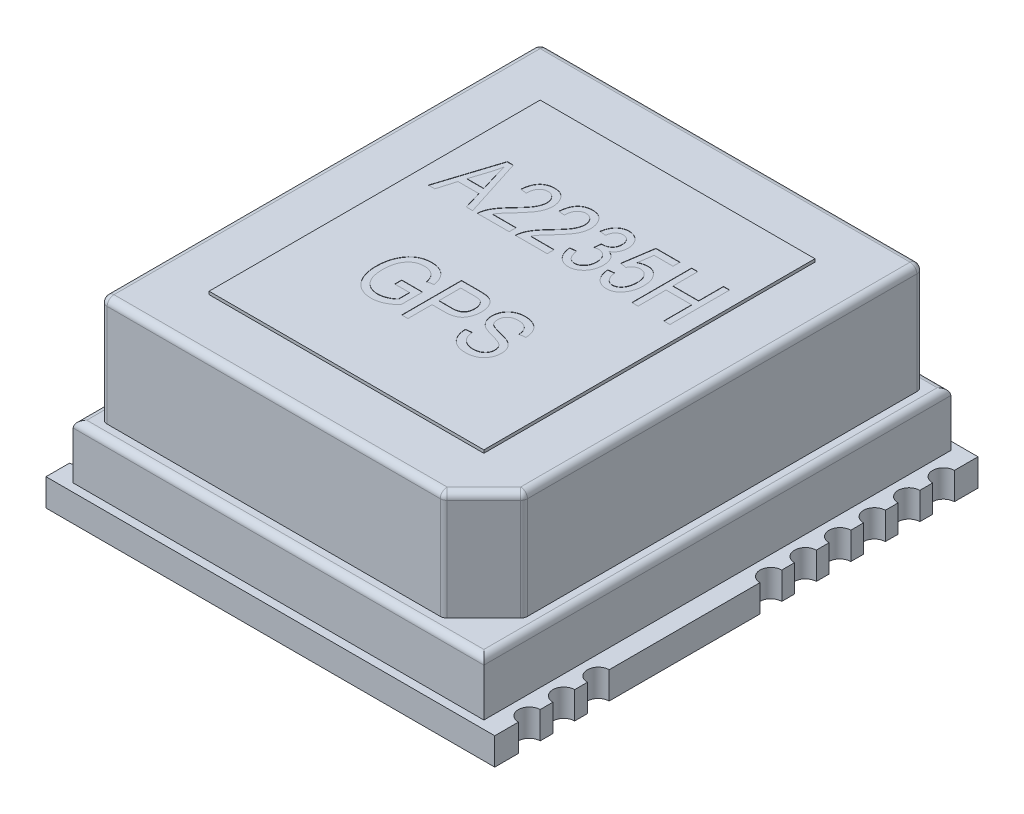
from build123d import *

# Parameters (mm, degrees)
SKETCH1_W           = 16.51
SKETCH1_H           = 17.78
BOSS_EXTRUDE1_DEPTH = 1
CUT_EXTRUDE1_DEPTH  = 1
SKETCH3_W           = 15.11
SKETCH3_H           = 17.18
BOSS_EXTRUDE2_DEPTH = 2
BOSS_EXTRUDE3_DEPTH = 4
SKETCH6_W           = 10.11
SKETCH6_H           = 12.18
BOSS_EXTRUDE4_DEPTH = 0.11
CUT_EXTRUDE2_DEPTH  = 0.01
FILLET1_R           = 0.25
FILLET2_R           = 0.25


with BuildPart() as part:
    # Sketch1 → Boss-Extrude1 (new body)
    with BuildSketch(Plane(origin=(0, 0, 0), x_dir=(1, 0, 0), z_dir=(0, 1, 0))):
        Rectangle(SKETCH1_W, SKETCH1_H)
    extrude(amount=BOSS_EXTRUDE1_DEPTH)

    # Sketch2 → Cut-Extrude1 (cut)
    with BuildSketch(Plane(origin=(0, 1, 0), x_dir=(1, 0, 0), z_dir=(0, 1, 0))):
        with BuildLine():
            ThreePointArc((-7.855, 7.62), (-7.972157288, 7.902842712), (-8.255, 8.02))
            Line((-8.255, 8.02), (-8.255, 7.22))
            ThreePointArc((-8.255, 7.22), (-7.972157288, 7.337157288), (-7.855, 7.62))
        make_face()
        with BuildLine():
            Line((-8.255, 7.22), (-8.255, 8.02))
            ThreePointArc((-8.255, 8.02), (-8.655, 7.62), (-8.255, 7.22))
        make_face()
        with BuildLine():
            ThreePointArc((-7.855, 7.62), (-7.972157288, 7.902842712), (-8.255, 8.02))
            Line((-8.255, 8.02), (-8.255, 7.22))
            ThreePointArc((-8.255, 7.22), (-7.972157288, 7.337157288), (-7.855, 7.62))
        make_face()
        with BuildLine():
            Line((-8.255, 7.22), (-8.255, 8.02))
            ThreePointArc((-8.255, 8.02), (-8.655, 7.62), (-8.255, 7.22))
        make_face()
        with BuildLine():
            ThreePointArc((-7.855, 6.35), (-7.972157288, 6.632842712), (-8.255, 6.75))
            Line((-8.255, 6.75), (-8.255, 5.95))
            ThreePointArc((-8.255, 5.95), (-7.972157288, 6.067157288), (-7.855, 6.35))
        make_face()
        with BuildLine():
            Line((-8.255, 5.95), (-8.255, 6.75))
            ThreePointArc((-8.255, 6.75), (-8.655, 6.35), (-8.255, 5.95))
        make_face()
        with BuildLine():
            ThreePointArc((-7.855, 6.35), (-7.972157288, 6.632842712), (-8.255, 6.75))
            Line((-8.255, 6.75), (-8.255, 5.95))
            ThreePointArc((-8.255, 5.95), (-7.972157288, 6.067157288), (-7.855, 6.35))
        make_face()
        with BuildLine():
            Line((-8.255, 5.95), (-8.255, 6.75))
            ThreePointArc((-8.255, 6.75), (-8.655, 6.35), (-8.255, 5.95))
        make_face()
        with BuildLine():
            ThreePointArc((-7.855, 5.08), (-7.972157288, 5.362842712), (-8.255, 5.48))
            Line((-8.255, 5.48), (-8.255, 4.68))
            ThreePointArc((-8.255, 4.68), (-7.972157288, 4.797157288), (-7.855, 5.08))
        make_face()
        with BuildLine():
            Line((-8.255, 4.68), (-8.255, 5.48))
            ThreePointArc((-8.255, 5.48), (-8.655, 5.08), (-8.255, 4.68))
        make_face()
        with BuildLine():
            ThreePointArc((-7.855, 5.08), (-7.972157288, 5.362842712), (-8.255, 5.48))
            Line((-8.255, 5.48), (-8.255, 4.68))
            ThreePointArc((-8.255, 4.68), (-7.972157288, 4.797157288), (-7.855, 5.08))
        make_face()
        with BuildLine():
            Line((-8.255, 4.68), (-8.255, 5.48))
            ThreePointArc((-8.255, 5.48), (-8.655, 5.08), (-8.255, 4.68))
        make_face()
        with BuildLine():
            ThreePointArc((-7.855, 3.81), (-7.972157288, 4.092842712), (-8.255, 4.21))
            Line((-8.255, 4.21), (-8.255, 3.41))
            ThreePointArc((-8.255, 3.41), (-7.972157288, 3.527157288), (-7.855, 3.81))
        make_face()
        with BuildLine():
            Line((-8.255, 3.41), (-8.255, 4.21))
            ThreePointArc((-8.255, 4.21), (-8.655, 3.81), (-8.255, 3.41))
        make_face()
        with BuildLine():
            ThreePointArc((-7.855, 3.81), (-7.972157288, 4.092842712), (-8.255, 4.21))
            Line((-8.255, 4.21), (-8.255, 3.41))
            ThreePointArc((-8.255, 3.41), (-7.972157288, 3.527157288), (-7.855, 3.81))
        make_face()
        with BuildLine():
            Line((-8.255, 3.41), (-8.255, 4.21))
            ThreePointArc((-8.255, 4.21), (-8.655, 3.81), (-8.255, 3.41))
        make_face()
        with BuildLine():
            ThreePointArc((-7.855, 2.54), (-7.972157288, 2.822842712), (-8.255, 2.94))
            Line((-8.255, 2.94), (-8.255, 2.14))
            ThreePointArc((-8.255, 2.14), (-7.972157288, 2.257157288), (-7.855, 2.54))
        make_face()
        with BuildLine():
            Line((-8.255, 2.14), (-8.255, 2.94))
            ThreePointArc((-8.255, 2.94), (-8.655, 2.54), (-8.255, 2.14))
        make_face()
        with BuildLine():
            ThreePointArc((-7.855, 2.54), (-7.972157288, 2.822842712), (-8.255, 2.94))
            Line((-8.255, 2.94), (-8.255, 2.14))
            ThreePointArc((-8.255, 2.14), (-7.972157288, 2.257157288), (-7.855, 2.54))
        make_face()
        with BuildLine():
            Line((-8.255, 2.14), (-8.255, 2.94))
            ThreePointArc((-8.255, 2.94), (-8.655, 2.54), (-8.255, 2.14))
        make_face()
        with BuildLine():
            ThreePointArc((-7.855, 1.27), (-7.972157288, 1.552842712), (-8.255, 1.67))
            Line((-8.255, 1.67), (-8.255, 0.87))
            ThreePointArc((-8.255, 0.87), (-7.972157288, 0.987157288), (-7.855, 1.27))
        make_face()
        with BuildLine():
            Line((-8.255, 0.87), (-8.255, 1.67))
            ThreePointArc((-8.255, 1.67), (-8.655, 1.27), (-8.255, 0.87))
        make_face()
        with BuildLine():
            ThreePointArc((-7.855, 1.27), (-7.972157288, 1.552842712), (-8.255, 1.67))
            Line((-8.255, 1.67), (-8.255, 0.87))
            ThreePointArc((-8.255, 0.87), (-7.972157288, 0.987157288), (-7.855, 1.27))
        make_face()
        with BuildLine():
            Line((-8.255, 0.87), (-8.255, 1.67))
            ThreePointArc((-8.255, 1.67), (-8.655, 1.27), (-8.255, 0.87))
        make_face()
        with BuildLine():
            ThreePointArc((-7.855, 0), (-7.972157288, 0.282842712), (-8.255, 0.4))
            Line((-8.255, 0.4), (-8.255, -0.4))
            ThreePointArc((-8.255, -0.4), (-7.972157288, -0.282842712), (-7.855, 0))
        make_face()
        with BuildLine():
            Line((-8.255, -0.4), (-8.255, 0.4))
            ThreePointArc((-8.255, 0.4), (-8.655, 0), (-8.255, -0.4))
        make_face()
        with BuildLine():
            ThreePointArc((-7.855, 0), (-7.972157288, 0.282842712), (-8.255, 0.4))
            Line((-8.255, 0.4), (-8.255, -0.4))
            ThreePointArc((-8.255, -0.4), (-7.972157288, -0.282842712), (-7.855, 0))
        make_face()
        with BuildLine():
            Line((-8.255, -0.4), (-8.255, 0.4))
            ThreePointArc((-8.255, 0.4), (-8.655, 0), (-8.255, -0.4))
        make_face()
        with BuildLine():
            ThreePointArc((-7.855, -1.27), (-7.972157288, -0.987157288), (-8.255, -0.87))
            Line((-8.255, -0.87), (-8.255, -1.67))
            ThreePointArc((-8.255, -1.67), (-7.972157288, -1.552842712), (-7.855, -1.27))
        make_face()
        with BuildLine():
            Line((-8.255, -1.67), (-8.255, -0.87))
            ThreePointArc((-8.255, -0.87), (-8.655, -1.27), (-8.255, -1.67))
        make_face()
        with BuildLine():
            ThreePointArc((-7.855, -1.27), (-7.972157288, -0.987157288), (-8.255, -0.87))
            Line((-8.255, -0.87), (-8.255, -1.67))
            ThreePointArc((-8.255, -1.67), (-7.972157288, -1.552842712), (-7.855, -1.27))
        make_face()
        with BuildLine():
            Line((-8.255, -1.67), (-8.255, -0.87))
            ThreePointArc((-8.255, -0.87), (-8.655, -1.27), (-8.255, -1.67))
        make_face()
        with BuildLine():
            ThreePointArc((-7.855, -2.54), (-7.972157288, -2.257157288), (-8.255, -2.14))
            Line((-8.255, -2.14), (-8.255, -2.94))
            ThreePointArc((-8.255, -2.94), (-7.972157288, -2.822842712), (-7.855, -2.54))
        make_face()
        with BuildLine():
            Line((-8.255, -2.94), (-8.255, -2.14))
            ThreePointArc((-8.255, -2.14), (-8.655, -2.54), (-8.255, -2.94))
        make_face()
        with BuildLine():
            ThreePointArc((-7.855, -2.54), (-7.972157288, -2.257157288), (-8.255, -2.14))
            Line((-8.255, -2.14), (-8.255, -2.94))
            ThreePointArc((-8.255, -2.94), (-7.972157288, -2.822842712), (-7.855, -2.54))
        make_face()
        with BuildLine():
            Line((-8.255, -2.94), (-8.255, -2.14))
            ThreePointArc((-8.255, -2.14), (-8.655, -2.54), (-8.255, -2.94))
        make_face()
        with BuildLine():
            ThreePointArc((-7.855, -3.81), (-7.972157288, -3.527157288), (-8.255, -3.41))
            Line((-8.255, -3.41), (-8.255, -4.21))
            ThreePointArc((-8.255, -4.21), (-7.972157288, -4.092842712), (-7.855, -3.81))
        make_face()
        with BuildLine():
            Line((-8.255, -4.21), (-8.255, -3.41))
            ThreePointArc((-8.255, -3.41), (-8.655, -3.81), (-8.255, -4.21))
        make_face()
        with BuildLine():
            ThreePointArc((-7.855, -3.81), (-7.972157288, -3.527157288), (-8.255, -3.41))
            Line((-8.255, -3.41), (-8.255, -4.21))
            ThreePointArc((-8.255, -4.21), (-7.972157288, -4.092842712), (-7.855, -3.81))
        make_face()
        with BuildLine():
            Line((-8.255, -4.21), (-8.255, -3.41))
            ThreePointArc((-8.255, -3.41), (-8.655, -3.81), (-8.255, -4.21))
        make_face()
        with BuildLine():
            ThreePointArc((-7.855, -5.08), (-7.972157288, -4.797157288), (-8.255, -4.68))
            Line((-8.255, -4.68), (-8.255, -5.48))
            ThreePointArc((-8.255, -5.48), (-7.972157288, -5.362842712), (-7.855, -5.08))
        make_face()
        with BuildLine():
            Line((-8.255, -5.48), (-8.255, -4.68))
            ThreePointArc((-8.255, -4.68), (-8.655, -5.08), (-8.255, -5.48))
        make_face()
        with BuildLine():
            ThreePointArc((-7.855, -5.08), (-7.972157288, -4.797157288), (-8.255, -4.68))
            Line((-8.255, -4.68), (-8.255, -5.48))
            ThreePointArc((-8.255, -5.48), (-7.972157288, -5.362842712), (-7.855, -5.08))
        make_face()
        with BuildLine():
            Line((-8.255, -5.48), (-8.255, -4.68))
            ThreePointArc((-8.255, -4.68), (-8.655, -5.08), (-8.255, -5.48))
        make_face()
        with BuildLine():
            ThreePointArc((-7.855, -6.35), (-7.972157288, -6.067157288), (-8.255, -5.95))
            Line((-8.255, -5.95), (-8.255, -6.75))
            ThreePointArc((-8.255, -6.75), (-7.972157288, -6.632842712), (-7.855, -6.35))
        make_face()
        with BuildLine():
            Line((-8.255, -6.75), (-8.255, -5.95))
            ThreePointArc((-8.255, -5.95), (-8.655, -6.35), (-8.255, -6.75))
        make_face()
        with BuildLine():
            ThreePointArc((-7.855, -6.35), (-7.972157288, -6.067157288), (-8.255, -5.95))
            Line((-8.255, -5.95), (-8.255, -6.75))
            ThreePointArc((-8.255, -6.75), (-7.972157288, -6.632842712), (-7.855, -6.35))
        make_face()
        with BuildLine():
            Line((-8.255, -6.75), (-8.255, -5.95))
            ThreePointArc((-8.255, -5.95), (-8.655, -6.35), (-8.255, -6.75))
        make_face()
        with BuildLine():
            ThreePointArc((-7.855, -7.62), (-7.972157288, -7.337157288), (-8.255, -7.22))
            Line((-8.255, -7.22), (-8.255, -8.02))
            ThreePointArc((-8.255, -8.02), (-7.972157288, -7.902842712), (-7.855, -7.62))
        make_face()
        with BuildLine():
            Line((-8.255, -8.02), (-8.255, -7.22))
            ThreePointArc((-8.255, -7.22), (-8.655, -7.62), (-8.255, -8.02))
        make_face()
        with BuildLine():
            ThreePointArc((-7.855, -7.62), (-7.972157288, -7.337157288), (-8.255, -7.22))
            Line((-8.255, -7.22), (-8.255, -8.02))
            ThreePointArc((-8.255, -8.02), (-7.972157288, -7.902842712), (-7.855, -7.62))
        make_face()
        with BuildLine():
            Line((-8.255, -8.02), (-8.255, -7.22))
            ThreePointArc((-8.255, -7.22), (-8.655, -7.62), (-8.255, -8.02))
        make_face()
        with BuildLine():
            ThreePointArc((8.655, 7.62), (8.537842712, 7.902842712), (8.255, 8.02))
            Line((8.255, 8.02), (8.255, 7.22))
            ThreePointArc((8.255, 7.22), (8.537842712, 7.337157288), (8.655, 7.62))
        make_face()
        with BuildLine():
            Line((8.255, 7.22), (8.255, 8.02))
            ThreePointArc((8.255, 8.02), (7.855, 7.62), (8.255, 7.22))
        make_face()
        with BuildLine():
            ThreePointArc((8.655, 7.62), (8.537842712, 7.902842712), (8.255, 8.02))
            Line((8.255, 8.02), (8.255, 7.22))
            ThreePointArc((8.255, 7.22), (8.537842712, 7.337157288), (8.655, 7.62))
        make_face()
        with BuildLine():
            Line((8.255, 7.22), (8.255, 8.02))
            ThreePointArc((8.255, 8.02), (7.855, 7.62), (8.255, 7.22))
        make_face()
        with BuildLine():
            ThreePointArc((8.655, 6.35), (8.537842712, 6.632842712), (8.255, 6.75))
            Line((8.255, 6.75), (8.255, 5.95))
            ThreePointArc((8.255, 5.95), (8.537842712, 6.067157288), (8.655, 6.35))
        make_face()
        with BuildLine():
            Line((8.255, 5.95), (8.255, 6.75))
            ThreePointArc((8.255, 6.75), (7.855, 6.35), (8.255, 5.95))
        make_face()
        with BuildLine():
            ThreePointArc((8.655, 6.35), (8.537842712, 6.632842712), (8.255, 6.75))
            Line((8.255, 6.75), (8.255, 5.95))
            ThreePointArc((8.255, 5.95), (8.537842712, 6.067157288), (8.655, 6.35))
        make_face()
        with BuildLine():
            Line((8.255, 5.95), (8.255, 6.75))
            ThreePointArc((8.255, 6.75), (7.855, 6.35), (8.255, 5.95))
        make_face()
        with BuildLine():
            ThreePointArc((8.655, 5.08), (8.537842712, 5.362842712), (8.255, 5.48))
            Line((8.255, 5.48), (8.255, 4.68))
            ThreePointArc((8.255, 4.68), (8.537842712, 4.797157288), (8.655, 5.08))
        make_face()
        with BuildLine():
            Line((8.255, 4.68), (8.255, 5.48))
            ThreePointArc((8.255, 5.48), (7.855, 5.08), (8.255, 4.68))
        make_face()
        with BuildLine():
            ThreePointArc((8.655, 5.08), (8.537842712, 5.362842712), (8.255, 5.48))
            Line((8.255, 5.48), (8.255, 4.68))
            ThreePointArc((8.255, 4.68), (8.537842712, 4.797157288), (8.655, 5.08))
        make_face()
        with BuildLine():
            Line((8.255, 4.68), (8.255, 5.48))
            ThreePointArc((8.255, 5.48), (7.855, 5.08), (8.255, 4.68))
        make_face()
        with BuildLine():
            ThreePointArc((8.655, 3.81), (8.537842712, 4.092842712), (8.255, 4.21))
            Line((8.255, 4.21), (8.255, 3.41))
            ThreePointArc((8.255, 3.41), (8.537842712, 3.527157288), (8.655, 3.81))
        make_face()
        with BuildLine():
            Line((8.255, 3.41), (8.255, 4.21))
            ThreePointArc((8.255, 4.21), (7.855, 3.81), (8.255, 3.41))
        make_face()
        with BuildLine():
            ThreePointArc((8.655, 3.81), (8.537842712, 4.092842712), (8.255, 4.21))
            Line((8.255, 4.21), (8.255, 3.41))
            ThreePointArc((8.255, 3.41), (8.537842712, 3.527157288), (8.655, 3.81))
        make_face()
        with BuildLine():
            Line((8.255, 3.41), (8.255, 4.21))
            ThreePointArc((8.255, 4.21), (7.855, 3.81), (8.255, 3.41))
        make_face()
        with BuildLine():
            ThreePointArc((8.655, 2.54), (8.537842712, 2.822842712), (8.255, 2.94))
            Line((8.255, 2.94), (8.255, 2.14))
            ThreePointArc((8.255, 2.14), (8.537842712, 2.257157288), (8.655, 2.54))
        make_face()
        with BuildLine():
            Line((8.255, 2.14), (8.255, 2.94))
            ThreePointArc((8.255, 2.94), (7.855, 2.54), (8.255, 2.14))
        make_face()
        with BuildLine():
            ThreePointArc((8.655, 2.54), (8.537842712, 2.822842712), (8.255, 2.94))
            Line((8.255, 2.94), (8.255, 2.14))
            ThreePointArc((8.255, 2.14), (8.537842712, 2.257157288), (8.655, 2.54))
        make_face()
        with BuildLine():
            Line((8.255, 2.14), (8.255, 2.94))
            ThreePointArc((8.255, 2.94), (7.855, 2.54), (8.255, 2.14))
        make_face()
        with BuildLine():
            ThreePointArc((8.655, 1.27), (8.537842712, 1.552842712), (8.255, 1.67))
            Line((8.255, 1.67), (8.255, 0.87))
            ThreePointArc((8.255, 0.87), (8.537842712, 0.987157288), (8.655, 1.27))
        make_face()
        with BuildLine():
            Line((8.255, 0.87), (8.255, 1.67))
            ThreePointArc((8.255, 1.67), (7.855, 1.27), (8.255, 0.87))
        make_face()
        with BuildLine():
            ThreePointArc((8.655, 1.27), (8.537842712, 1.552842712), (8.255, 1.67))
            Line((8.255, 1.67), (8.255, 0.87))
            ThreePointArc((8.255, 0.87), (8.537842712, 0.987157288), (8.655, 1.27))
        make_face()
        with BuildLine():
            Line((8.255, 0.87), (8.255, 1.67))
            ThreePointArc((8.255, 1.67), (7.855, 1.27), (8.255, 0.87))
        make_face()
        with BuildLine():
            ThreePointArc((8.655, -5.08), (8.537842712, -4.797157288), (8.255, -4.68))
            Line((8.255, -4.68), (8.255, -5.48))
            ThreePointArc((8.255, -5.48), (8.537842712, -5.362842712), (8.655, -5.08))
        make_face()
        with BuildLine():
            Line((8.255, -5.48), (8.255, -4.68))
            ThreePointArc((8.255, -4.68), (7.855, -5.08), (8.255, -5.48))
        make_face()
        with BuildLine():
            ThreePointArc((8.655, -5.08), (8.537842712, -4.797157288), (8.255, -4.68))
            Line((8.255, -4.68), (8.255, -5.48))
            ThreePointArc((8.255, -5.48), (8.537842712, -5.362842712), (8.655, -5.08))
        make_face()
        with BuildLine():
            Line((8.255, -5.48), (8.255, -4.68))
            ThreePointArc((8.255, -4.68), (7.855, -5.08), (8.255, -5.48))
        make_face()
        with BuildLine():
            ThreePointArc((8.655, -6.35), (8.537842712, -6.067157288), (8.255, -5.95))
            Line((8.255, -5.95), (8.255, -6.75))
            ThreePointArc((8.255, -6.75), (8.537842712, -6.632842712), (8.655, -6.35))
        make_face()
        with BuildLine():
            Line((8.255, -6.75), (8.255, -5.95))
            ThreePointArc((8.255, -5.95), (7.855, -6.35), (8.255, -6.75))
        make_face()
        with BuildLine():
            ThreePointArc((8.655, -6.35), (8.537842712, -6.067157288), (8.255, -5.95))
            Line((8.255, -5.95), (8.255, -6.75))
            ThreePointArc((8.255, -6.75), (8.537842712, -6.632842712), (8.655, -6.35))
        make_face()
        with BuildLine():
            Line((8.255, -6.75), (8.255, -5.95))
            ThreePointArc((8.255, -5.95), (7.855, -6.35), (8.255, -6.75))
        make_face()
        with BuildLine():
            ThreePointArc((8.655, -7.62), (8.537842712, -7.337157288), (8.255, -7.22))
            Line((8.255, -7.22), (8.255, -8.02))
            ThreePointArc((8.255, -8.02), (8.537842712, -7.902842712), (8.655, -7.62))
        make_face()
        with BuildLine():
            Line((8.255, -8.02), (8.255, -7.22))
            ThreePointArc((8.255, -7.22), (7.855, -7.62), (8.255, -8.02))
        make_face()
        with BuildLine():
            ThreePointArc((8.655, -7.62), (8.537842712, -7.337157288), (8.255, -7.22))
            Line((8.255, -7.22), (8.255, -8.02))
            ThreePointArc((8.255, -8.02), (8.537842712, -7.902842712), (8.655, -7.62))
        make_face()
        with BuildLine():
            Line((8.255, -8.02), (8.255, -7.22))
            ThreePointArc((8.255, -7.22), (7.855, -7.62), (8.255, -8.02))
        make_face()
    extrude(amount=-CUT_EXTRUDE1_DEPTH, mode=Mode.SUBTRACT)

    # Sketch3 → Boss-Extrude2 (add)
    with BuildSketch(Plane(origin=(0, 1, 0), x_dir=(1, 0, 0), z_dir=(0, 1, 0))):
        Rectangle(SKETCH3_W, SKETCH3_H)
    extrude(amount=BOSS_EXTRUDE2_DEPTH)

    # Sketch4 → Boss-Extrude3 (add)
    with BuildSketch(Plane(origin=(0, 3, 0), x_dir=(1, 0, 0), z_dir=(0, 1, 0))):
        Polygon((7.055, 8.09), (-7.055, 8.09), (-7.055, -8.09), (5.555, -8.09), (7.055, -6.59), align=None)
    extrude(amount=BOSS_EXTRUDE3_DEPTH)

    # Sketch6 → Boss-Extrude4 (add)
    with BuildSketch(Plane(origin=(0, 7, 0), x_dir=(1, 0, 0), z_dir=(0, 1, 0))):
        Rectangle(SKETCH6_W, SKETCH6_H)
    extrude(amount=BOSS_EXTRUDE4_DEPTH)

    # Sketch7 → Cut-Extrude2 (cut)
    # profile 1 of 9: a face of its own
    with BuildSketch(Plane(origin=(0, 7.11, 0), x_dir=(1, 0, 0), z_dir=(0, 1, 0))):
        Polygon((-4.401092585, 1.324936249), (-3.698414013, 3.524936249), (-3.475646156, 3.524936249), (-2.772521156, 1.324936249), (-3.010021156, 1.324936249), (-3.202431871, 1.982079106), (-3.971181871, 1.982079106), (-4.163146156, 1.324936249), align=None)
        with BuildLine():
            Line((-3.896181871, 2.239221964), (-3.277878299, 2.239221964))
            Line((-3.277878299, 2.239221964), (-3.461806871, 2.843686249))
            add(Edge.make_bspline(
                [(-3.461806871, 2.843686249), (-3.468687684, 2.866294739), (-3.482121471, 2.910434519), (-3.501144937, 2.975068742), (-3.519403142, 3.036373095), (-3.534999167, 3.094775208), (-3.550507553, 3.149515212), (-3.563882481, 3.201202273), (-3.575888708, 3.249579874), (-3.583263973, 3.28088174), (-3.586806871, 3.295918392)],
                knots=[0, 0, 0, 0, 1.20859176, 2.359599242, 3.445754582, 4.479676267, 5.450859039, 6.355343929, 7.209947359, 8, 8, 8, 8], degree=3))
            add(Edge.make_bspline(
                [(-3.586806871, 3.295918392), (-3.593238758, 3.260893935), (-3.60609399, 3.190891545), (-3.630190616, 3.086610011), (-3.656998843, 2.982516657), (-3.678337204, 2.913842584), (-3.689039013, 2.879400535)],
                knots=[0, 0, 0, 0, 0.995500629, 1.989678841, 2.991765375, 4, 4, 4, 4], degree=3))
            Line((-3.689039013, 2.879400535), (-3.896181871, 2.239221964))
        make_face(mode=Mode.SUBTRACT)
    # profile 2 of 9: a face of its own
    with BuildSketch(Plane(origin=(0, 7.11, 0), x_dir=(1, 0, 0), z_dir=(0, 1, 0))):
        with BuildLine():
            Line((-1.429664013, 1.582079106), (-1.429664013, 1.324936249))
            Line((-1.429664013, 1.324936249), (-2.601092585, 1.324936249))
            add(Edge.make_bspline(
                [(-2.601092585, 1.324936249), (-2.601146823, 1.338334468), (-2.60125671, 1.365479478), (-2.597603318, 1.406864442), (-2.590097111, 1.44925136), (-2.58051245, 1.493205679), (-2.566922447, 1.538149307), (-2.550285762, 1.584300623), (-2.530655937, 1.631544726), (-2.507671203, 1.680161415), (-2.480812384, 1.730617027), (-2.448401574, 1.782700465), (-2.411153516, 1.837345989), (-2.369018951, 1.894220463), (-2.321173825, 1.952784499), (-2.269038234, 2.013907475), (-2.21186813, 2.077462081), (-2.171162894, 2.119701062), (-2.150199728, 2.141454106)],
                knots=[0, 0, 0, 0, 0.672188691, 1.361865275, 2.08134618, 2.831455259, 3.618325166, 4.435686407, 5.292818481, 6.184803937, 7.133719261, 8.159707436, 9.261705982, 10.452168352, 11.710682541, 13.056179633, 14.483934645, 16, 16, 16, 16], degree=3))
            add(Edge.make_bspline(
                [(-2.150199728, 2.141454106), (-2.125838178, 2.166651961), (-2.078931909, 2.215168469), (-2.012915815, 2.286806066), (-1.952933563, 2.353392323), (-1.90018356, 2.416131315), (-1.853729301, 2.474168555), (-1.813103404, 2.527421063), (-1.780247382, 2.577097371), (-1.74477222, 2.635548682), (-1.710951693, 2.705134042), (-1.681052431, 2.78624679), (-1.661733681, 2.864658679), (-1.659378821, 2.916353967), (-1.658235442, 2.941454106)],
                knots=[0, 0, 0, 0, 1.312560889, 2.527233899, 3.64818266, 4.668586789, 5.596397896, 6.432357998, 7.175835261, 7.825761013, 8.992224112, 10.065918602, 11.060925749, 12, 12, 12, 12], degree=3))
            add(Edge.make_bspline(
                [(-1.658235442, 2.941454106), (-1.658394871, 2.955311382), (-1.658706251, 2.98237609), (-1.663997733, 3.021901202), (-1.671544081, 3.059495704), (-1.681507499, 3.095431301), (-1.695634475, 3.129117741), (-1.712560976, 3.160788744), (-1.732387969, 3.19058775), (-1.755013579, 3.21807715), (-1.77996448, 3.242876025), (-1.806259229, 3.265154699), (-1.834581862, 3.283186024), (-1.863768312, 3.298882657), (-1.894804847, 3.310258617), (-1.927037917, 3.318930039), (-1.96076574, 3.323819382), (-1.983667168, 3.324560269), (-1.995289013, 3.324936249)],
                knots=[0, 0, 0, 0, 1.164486654, 2.274364258, 3.346924328, 4.388668322, 5.404300818, 6.412115579, 7.404820287, 8.409522099, 9.400647826, 10.360464378, 11.301161788, 12.219192522, 13.141987859, 14.073903283, 15.022558797, 16, 16, 16, 16], degree=3))
            add(Edge.make_bspline(
                [(-1.995289013, 3.324936249), (-2.007819642, 3.324673372), (-2.032280004, 3.324160223), (-2.067932578, 3.317783172), (-2.102094291, 3.309251937), (-2.134591794, 3.296020735), (-2.165187381, 3.279072372), (-2.194321798, 3.258671792), (-2.221424775, 3.234433381), (-2.247042281, 3.206871406), (-2.269499288, 3.17544202), (-2.290118114, 3.141431988), (-2.306354572, 3.103400647), (-2.320160245, 3.062520694), (-2.330972259, 3.018315604), (-2.338199228, 2.970952093), (-2.343499122, 2.920441708), (-2.343796763, 2.885665589), (-2.343949728, 2.867793392)],
                knots=[0, 0, 0, 0, 0.928788257, 1.813037313, 2.680996359, 3.53827917, 4.408273621, 5.272359245, 6.172129225, 7.102295458, 8.058839945, 9.034325244, 10.048074492, 11.120300332, 12.234644845, 13.420320921, 14.674247329, 16, 16, 16, 16], degree=3))
            Line((-2.343949728, 2.867793392), (-2.572521156, 2.896364821))
            add(Edge.make_bspline(
                [(-2.572521156, 2.896364821), (-2.570165616, 2.922888718), (-2.565595762, 2.974346282), (-2.553605736, 3.048839095), (-2.536967417, 3.11795508), (-2.517216694, 3.182383753), (-2.492368007, 3.241325522), (-2.464586389, 3.295853058), (-2.431658516, 3.344781032), (-2.394938506, 3.388714329), (-2.354733872, 3.427692121), (-2.311271215, 3.461336878), (-2.264609553, 3.489698773), (-2.215281767, 3.513546553), (-2.162268226, 3.531355013), (-2.106519995, 3.544279993), (-2.047583651, 3.551937369), (-2.007365044, 3.55297651), (-1.986806871, 3.553507678)],
                knots=[0, 0, 0, 0, 1.296155121, 2.514599762, 3.669097984, 4.755193195, 5.79120272, 6.77953026, 7.729955905, 8.65570694, 9.562583864, 10.450894749, 11.325630111, 12.216772649, 13.112585423, 14.04224033, 14.999270054, 16, 16, 16, 16], degree=3))
            add(Edge.make_bspline(
                [(-1.986806871, 3.553507678), (-1.964609991, 3.552856113), (-1.921388981, 3.551587407), (-1.858469377, 3.543227644), (-1.799785345, 3.528481587), (-1.745074764, 3.507962219), (-1.694994693, 3.480949036), (-1.648730531, 3.448545985), (-1.607054376, 3.409768047), (-1.569966401, 3.365644226), (-1.537189958, 3.318007263), (-1.508590369, 3.268195383), (-1.483782522, 3.21703396), (-1.464394488, 3.163953711), (-1.448203416, 3.109667012), (-1.438031831, 3.053350948), (-1.430871109, 2.995655305), (-1.430068651, 2.956655422), (-1.429664013, 2.936989821)],
                knots=[0, 0, 0, 0, 1.141256367, 2.222215694, 3.255808886, 4.246221905, 5.218350639, 6.173592628, 7.142736081, 8.136099926, 9.131465336, 10.11177911, 11.087094076, 12.050634184, 13.014356534, 13.995714735, 14.989343724, 16, 16, 16, 16], degree=3))
            add(Edge.make_bspline(
                [(-1.429664013, 2.936989821), (-1.430045259, 2.919271974), (-1.430802783, 2.884067116), (-1.435730538, 2.831539471), (-1.444428941, 2.77971802), (-1.455723433, 2.728104484), (-1.471750395, 2.677498023), (-1.489893771, 2.627094885), (-1.511900279, 2.577463684), (-1.537879509, 2.527635631), (-1.568297812, 2.475847431), (-1.604749, 2.421153892), (-1.646557083, 2.362093035), (-1.695420241, 2.299717194), (-1.74897081, 2.232232612), (-1.809574565, 2.161339708), (-1.87604909, 2.086413329), (-1.922882327, 2.035573377), (-1.947074728, 2.009311249)],
                knots=[0, 0, 0, 0, 0.78053567, 1.550902233, 2.321464013, 3.094364546, 3.87611052, 4.657966429, 5.453363508, 6.265521698, 7.132350641, 8.097801917, 9.160103787, 10.319208993, 11.587678713, 12.955014444, 14.427067756, 16, 16, 16, 16], degree=3))
            add(Edge.make_bspline(
                [(-1.947074728, 2.009311249), (-1.96243289, 1.992970912), (-1.991783573, 1.961743215), (-2.033347656, 1.916556347), (-2.070645583, 1.875450415), (-2.104489396, 1.839004113), (-2.133205936, 1.805991754), (-2.158102832, 1.777285402), (-2.178445507, 1.752531225), (-2.208932791, 1.71361611), (-2.247385155, 1.658785066), (-2.273951048, 1.6070937), (-2.286806871, 1.582079106)],
                knots=[0, 0, 0, 0, 1.227496676, 2.345844757, 3.360613726, 4.265798447, 5.068085109, 5.75545707, 6.345771879, 6.821573405, 8.46188917, 10, 10, 10, 10], degree=3))
            Line((-2.286806871, 1.582079106), (-1.429664013, 1.582079106))
        make_face()
    # profile 3 of 9: a face of its own
    with BuildSketch(Plane(origin=(0, 7.11, 0), x_dir=(1, 0, 0), z_dir=(0, 1, 0))):
        with BuildLine():
            Line((-0.029664013, 1.582079106), (-0.029664013, 1.324936249))
            Line((-0.029664013, 1.324936249), (-1.201092585, 1.324936249))
            add(Edge.make_bspline(
                [(-1.201092585, 1.324936249), (-1.201146823, 1.338334468), (-1.20125671, 1.365479478), (-1.197603318, 1.406864442), (-1.190097111, 1.44925136), (-1.18051245, 1.493205679), (-1.166922447, 1.538149307), (-1.150285762, 1.584300623), (-1.130655937, 1.631544726), (-1.107671203, 1.680161415), (-1.080812384, 1.730617027), (-1.048401574, 1.782700465), (-1.011153516, 1.837345989), (-0.969018951, 1.894220463), (-0.921173825, 1.952784499), (-0.869038234, 2.013907475), (-0.81186813, 2.077462081), (-0.771162894, 2.119701062), (-0.750199728, 2.141454106)],
                knots=[0, 0, 0, 0, 0.672188691, 1.361865275, 2.08134618, 2.831455259, 3.618325166, 4.435686407, 5.292818481, 6.184803937, 7.133719261, 8.159707436, 9.261705982, 10.452168352, 11.710682541, 13.056179633, 14.483934645, 16, 16, 16, 16], degree=3))
            add(Edge.make_bspline(
                [(-0.750199728, 2.141454106), (-0.725838178, 2.166651961), (-0.678931909, 2.215168469), (-0.612915815, 2.286806066), (-0.552933563, 2.353392323), (-0.50018356, 2.416131315), (-0.453729301, 2.474168555), (-0.413103404, 2.527421063), (-0.380247382, 2.577097371), (-0.34477222, 2.635548682), (-0.310951693, 2.705134042), (-0.281052431, 2.78624679), (-0.261733681, 2.864658679), (-0.259378821, 2.916353967), (-0.258235442, 2.941454106)],
                knots=[0, 0, 0, 0, 1.312560889, 2.527233899, 3.64818266, 4.668586789, 5.596397896, 6.432357998, 7.175835261, 7.825761013, 8.992224112, 10.065918602, 11.060925749, 12, 12, 12, 12], degree=3))
            add(Edge.make_bspline(
                [(-0.258235442, 2.941454106), (-0.258394871, 2.955311382), (-0.258706251, 2.98237609), (-0.263997733, 3.021901202), (-0.271544081, 3.059495704), (-0.281507499, 3.095431301), (-0.295634475, 3.129117741), (-0.312560976, 3.160788744), (-0.332387969, 3.19058775), (-0.355013579, 3.21807715), (-0.37996448, 3.242876025), (-0.406259229, 3.265154699), (-0.434581862, 3.283186024), (-0.463768312, 3.298882657), (-0.494804847, 3.310258617), (-0.527037917, 3.318930039), (-0.56076574, 3.323819382), (-0.583667168, 3.324560269), (-0.595289013, 3.324936249)],
                knots=[0, 0, 0, 0, 1.164486654, 2.274364258, 3.346924328, 4.388668322, 5.404300818, 6.412115579, 7.404820287, 8.409522099, 9.400647826, 10.360464378, 11.301161788, 12.219192522, 13.141987859, 14.073903283, 15.022558797, 16, 16, 16, 16], degree=3))
            add(Edge.make_bspline(
                [(-0.595289013, 3.324936249), (-0.607819642, 3.324673372), (-0.632280004, 3.324160223), (-0.667932578, 3.317783172), (-0.702094291, 3.309251937), (-0.734591794, 3.296020735), (-0.765187381, 3.279072372), (-0.794321798, 3.258671792), (-0.821424775, 3.234433381), (-0.847042281, 3.206871406), (-0.869499288, 3.17544202), (-0.890118114, 3.141431988), (-0.906354572, 3.103400647), (-0.920160245, 3.062520694), (-0.930972259, 3.018315604), (-0.938199228, 2.970952093), (-0.943499122, 2.920441708), (-0.943796763, 2.885665589), (-0.943949728, 2.867793392)],
                knots=[0, 0, 0, 0, 0.928788257, 1.813037313, 2.680996359, 3.53827917, 4.408273621, 5.272359245, 6.172129225, 7.102295458, 8.058839945, 9.034325244, 10.048074492, 11.120300332, 12.234644845, 13.420320921, 14.674247329, 16, 16, 16, 16], degree=3))
            Line((-0.943949728, 2.867793392), (-1.172521156, 2.896364821))
            add(Edge.make_bspline(
                [(-1.172521156, 2.896364821), (-1.170165616, 2.922888718), (-1.165595762, 2.974346282), (-1.153605736, 3.048839095), (-1.136967417, 3.11795508), (-1.117216694, 3.182383753), (-1.092368007, 3.241325522), (-1.064586389, 3.295853058), (-1.031658516, 3.344781032), (-0.994938506, 3.388714329), (-0.954733872, 3.427692121), (-0.911271215, 3.461336878), (-0.864609553, 3.489698773), (-0.815281767, 3.513546553), (-0.762268226, 3.531355013), (-0.706519995, 3.544279993), (-0.647583651, 3.551937369), (-0.607365044, 3.55297651), (-0.586806871, 3.553507678)],
                knots=[0, 0, 0, 0, 1.296155121, 2.514599762, 3.669097984, 4.755193195, 5.79120272, 6.77953026, 7.729955905, 8.65570694, 9.562583864, 10.450894749, 11.325630111, 12.216772649, 13.112585423, 14.04224033, 14.999270054, 16, 16, 16, 16], degree=3))
            add(Edge.make_bspline(
                [(-0.586806871, 3.553507678), (-0.564609991, 3.552856113), (-0.521388981, 3.551587407), (-0.458469377, 3.543227644), (-0.399785345, 3.528481587), (-0.345074764, 3.507962219), (-0.294994693, 3.480949036), (-0.248730531, 3.448545985), (-0.207054376, 3.409768047), (-0.169966401, 3.365644226), (-0.137189958, 3.318007263), (-0.108590369, 3.268195383), (-0.083782522, 3.21703396), (-0.064394488, 3.163953711), (-0.048203416, 3.109667012), (-0.038031831, 3.053350948), (-0.030871109, 2.995655305), (-0.030068651, 2.956655422), (-0.029664013, 2.936989821)],
                knots=[0, 0, 0, 0, 1.141256367, 2.222215694, 3.255808886, 4.246221905, 5.218350639, 6.173592628, 7.142736081, 8.136099926, 9.131465336, 10.11177911, 11.087094076, 12.050634184, 13.014356534, 13.995714735, 14.989343724, 16, 16, 16, 16], degree=3))
            add(Edge.make_bspline(
                [(-0.029664013, 2.936989821), (-0.030045259, 2.919271974), (-0.030802783, 2.884067116), (-0.035730538, 2.831539471), (-0.044428941, 2.77971802), (-0.055723433, 2.728104484), (-0.071750395, 2.677498023), (-0.089893771, 2.627094885), (-0.111900279, 2.577463684), (-0.137879509, 2.527635631), (-0.168297812, 2.475847431), (-0.204749, 2.421153892), (-0.246557083, 2.362093035), (-0.295420241, 2.299717194), (-0.34897081, 2.232232612), (-0.409574565, 2.161339708), (-0.47604909, 2.086413329), (-0.522882327, 2.035573377), (-0.547074728, 2.009311249)],
                knots=[0, 0, 0, 0, 0.78053567, 1.550902233, 2.321464013, 3.094364546, 3.87611052, 4.657966429, 5.453363508, 6.265521698, 7.132350641, 8.097801917, 9.160103787, 10.319208993, 11.587678713, 12.955014444, 14.427067756, 16, 16, 16, 16], degree=3))
            add(Edge.make_bspline(
                [(-0.547074728, 2.009311249), (-0.56243289, 1.992970912), (-0.591783573, 1.961743215), (-0.633347656, 1.916556347), (-0.670645583, 1.875450415), (-0.704489396, 1.839004113), (-0.733205936, 1.805991754), (-0.758102832, 1.777285402), (-0.778445507, 1.752531225), (-0.808932791, 1.71361611), (-0.847385155, 1.658785066), (-0.873951048, 1.6070937), (-0.886806871, 1.582079106)],
                knots=[0, 0, 0, 0, 1.227496676, 2.345844757, 3.360613726, 4.265798447, 5.068085109, 5.75545707, 6.345771879, 6.821573405, 8.46188917, 10, 10, 10, 10], degree=3))
            Line((-0.886806871, 1.582079106), (-0.029664013, 1.582079106))
        make_face()
    # profile 4 of 9: a face of its own
    with BuildSketch(Plane(origin=(0, 7.11, 0), x_dir=(1, 0, 0), z_dir=(0, 1, 0))):
        with BuildLine():
            Line((0.198907415, 1.924936249), (0.427478844, 1.953507678))
            add(Edge.make_bspline(
                [(0.427478844, 1.953507678), (0.43042679, 1.936210798), (0.436171257, 1.902505509), (0.447473823, 1.854002163), (0.459809508, 1.808615638), (0.474106841, 1.766773202), (0.48969135, 1.728066149), (0.506973521, 1.692741283), (0.526295626, 1.66080452), (0.547182061, 1.632237347), (0.569697339, 1.606904484), (0.593739038, 1.58497187), (0.619532318, 1.566455194), (0.646831304, 1.551045371), (0.676067995, 1.539613716), (0.70666794, 1.530889089), (0.739080751, 1.526036596), (0.761243487, 1.525308361), (0.772568129, 1.524936249)],
                knots=[0, 0, 0, 0, 1.392235382, 2.712957193, 3.95076201, 5.123471921, 6.220028287, 7.260520794, 8.240826993, 9.178593426, 10.065213643, 10.926376853, 11.755607984, 12.580369742, 13.407158359, 14.241002189, 15.101193065, 16, 16, 16, 16], degree=3))
            add(Edge.make_bspline(
                [(0.772568129, 1.524936249), (0.784954388, 1.525171924), (0.809299789, 1.525635148), (0.844976313, 1.532535999), (0.879638026, 1.541957223), (0.912687247, 1.556631135), (0.944705935, 1.574661648), (0.97573419, 1.596415118), (1.004552672, 1.623307699), (1.032616365, 1.652869624), (1.058499879, 1.685687823), (1.080817583, 1.721532514), (1.099613468, 1.759878322), (1.115385808, 1.800266637), (1.126672739, 1.843353954), (1.13597051, 1.88828158), (1.140634427, 1.935999201), (1.14138158, 1.968529591), (1.141764558, 1.985204106)],
                knots=[0, 0, 0, 0, 0.904038564, 1.776903143, 2.648138989, 3.525264603, 4.411852617, 5.332561374, 6.2875971, 7.288147468, 8.311042921, 9.337403868, 10.368883854, 11.429611823, 12.501164111, 13.621320171, 14.780729868, 16, 16, 16, 16], degree=3))
            add(Edge.make_bspline(
                [(1.141764558, 1.985204106), (1.141359724, 2.000838408), (1.140571526, 2.031277893), (1.13623632, 2.075802513), (1.128293183, 2.117985229), (1.11642496, 2.15771082), (1.102370768, 2.195591205), (1.084431722, 2.230852988), (1.063262573, 2.263697989), (1.039313065, 2.293893093), (1.012871574, 2.321106021), (0.984985773, 2.345327808), (0.955203523, 2.365456878), (0.924275305, 2.38240592), (0.891357692, 2.394589059), (0.857409945, 2.404286519), (0.821696343, 2.4096425), (0.797435802, 2.410310168), (0.785068129, 2.410650535)],
                knots=[0, 0, 0, 0, 1.208507307, 2.352925112, 3.453685551, 4.520081629, 5.553915499, 6.572344605, 7.570902253, 8.569592363, 9.545641393, 10.499968035, 11.418701314, 12.319183888, 13.218416966, 14.125267075, 15.044288268, 16, 16, 16, 16], degree=3))
            add(Edge.make_bspline(
                [(0.785068129, 2.410650535), (0.773884568, 2.410298573), (0.75004429, 2.409548286), (0.71250438, 2.403059745), (0.670959412, 2.393940173), (0.642446849, 2.38499124), (0.627478844, 2.380293392)],
                knots=[0, 0, 0, 0, 0.832645691, 1.774971563, 2.831945141, 4, 4, 4, 4], degree=3))
            Line((0.627478844, 2.380293392), (0.656050272, 2.639221964))
            Line((0.656050272, 2.639221964), (0.690425272, 2.636096964))
            add(Edge.make_bspline(
                [(0.690425272, 2.636096964), (0.703690465, 2.636247405), (0.729575341, 2.636540968), (0.767432466, 2.641965864), (0.803545198, 2.649153111), (0.837548172, 2.660061117), (0.869854708, 2.673470018), (0.899961472, 2.690466207), (0.928417722, 2.710284268), (0.954714639, 2.73292516), (0.97832163, 2.758521643), (0.999409902, 2.785999911), (1.016841158, 2.815789434), (1.031325802, 2.847307631), (1.042432178, 2.881010029), (1.050537504, 2.916719565), (1.054845686, 2.95459389), (1.055641872, 2.980432474), (1.056050272, 2.993686249)],
                knots=[0, 0, 0, 0, 1.104467345, 2.155189185, 3.181695374, 4.170183668, 5.126157628, 6.092295424, 7.04536858, 8.012620263, 8.977961638, 9.942904556, 10.893715412, 11.848320646, 12.828840281, 13.845861792, 14.895045293, 16, 16, 16, 16], degree=3))
            add(Edge.make_bspline(
                [(1.056050272, 2.993686249), (1.055025818, 3.017427341), (1.053057, 3.063053473), (1.03794407, 3.128038385), (1.011609104, 3.18556016), (0.975355681, 3.234739898), (0.931729343, 3.274370936), (0.882993555, 3.304070136), (0.828944076, 3.321666977), (0.79129551, 3.323833085), (0.772121701, 3.324936249)],
                knots=[0, 0, 0, 0, 1.168747258, 2.246123166, 3.262822778, 4.26410748, 5.234436762, 6.148309006, 7.056963545, 8, 8, 8, 8], degree=3))
            add(Edge.make_bspline(
                [(0.772121701, 3.324936249), (0.75219838, 3.324009902), (0.713440614, 3.322207834), (0.658019517, 3.305016874), (0.607031448, 3.27868229), (0.569863227, 3.247008424), (0.543524163, 3.21702003), (0.524939978, 3.191749912), (0.508426306, 3.163649823), (0.494430852, 3.132468854), (0.480960994, 3.099067798), (0.471434939, 3.062307175), (0.461919987, 3.023307329), (0.458048264, 2.996112775), (0.456050272, 2.982079106)],
                knots=[0, 0, 0, 0, 1.389180941, 2.702438466, 4.019316734, 5.377896697, 6.085434137, 6.807430375, 7.567469407, 8.358691296, 9.195188439, 10.081130764, 11.009773198, 12, 12, 12, 12], degree=3))
            Line((0.456050272, 2.982079106), (0.227478844, 3.010650535))
            add(Edge.make_bspline(
                [(0.227478844, 3.010650535), (0.231221551, 3.032432341), (0.238522454, 3.07492214), (0.253775747, 3.136062619), (0.271929188, 3.193180454), (0.293908652, 3.245961124), (0.318865342, 3.294862838), (0.347101517, 3.339679223), (0.378249402, 3.380704514), (0.413391114, 3.416805586), (0.450740837, 3.448958994), (0.490320262, 3.47672727), (0.531423717, 3.50062834), (0.574728682, 3.519883454), (0.619828533, 3.535151861), (0.666949082, 3.545836576), (0.715848215, 3.552153016), (0.749037704, 3.553051805), (0.765871701, 3.553507678)],
                knots=[0, 0, 0, 0, 1.259750421, 2.457396855, 3.589696629, 4.673763457, 5.713494597, 6.716289503, 7.690389722, 8.644478697, 9.583164327, 10.496506905, 11.397350125, 12.289843847, 13.194037124, 14.107891875, 15.040306322, 16, 16, 16, 16], degree=3))
            add(Edge.make_bspline(
                [(0.765871701, 3.553507678), (0.783609259, 3.552984461), (0.818505199, 3.551955111), (0.869794919, 3.544056998), (0.919121644, 3.531746462), (0.966354053, 3.513798458), (1.011072318, 3.490156602), (1.054377942, 3.462433482), (1.095540742, 3.429217885), (1.133915587, 3.391052482), (1.169140265, 3.349288773), (1.200036073, 3.304415956), (1.2265728, 3.257191585), (1.247644796, 3.206931561), (1.264115459, 3.154143285), (1.276151217, 3.098740908), (1.283521171, 3.040612028), (1.28424929, 3.001000099), (1.284621701, 2.980739821)],
                knots=[0, 0, 0, 0, 0.987546189, 1.94284647, 2.883618689, 3.814886987, 4.749064414, 5.696240478, 6.674807358, 7.688712876, 8.706405422, 9.713376545, 10.718845743, 11.717906576, 12.742863162, 13.794678478, 14.872046121, 16, 16, 16, 16], degree=3))
            add(Edge.make_bspline(
                [(1.284621701, 2.980739821), (1.283934013, 2.956276365), (1.282590967, 2.908499593), (1.269645416, 2.839195358), (1.249100864, 2.77417614), (1.220446282, 2.713874416), (1.184739336, 2.658599989), (1.141850834, 2.609706555), (1.092903676, 2.566367779), (1.055686413, 2.543599994), (1.036853844, 2.532079106)],
                knots=[0, 0, 0, 0, 1.090109576, 2.128968013, 3.132278696, 4.123864162, 5.09769889, 6.057339906, 7.016980922, 8, 8, 8, 8], degree=3))
            add(Edge.make_bspline(
                [(1.036853844, 2.532079106), (1.054152788, 2.526756403), (1.087952729, 2.516356515), (1.134582299, 2.492936493), (1.177100515, 2.465738574), (1.215091315, 2.433115814), (1.24888039, 2.39505717), (1.279051843, 2.351298379), (1.304974593, 2.301421221), (1.328394481, 2.246668838), (1.346747936, 2.187080224), (1.360848762, 2.123846744), (1.368844815, 2.056987464), (1.369831402, 2.011266435), (1.370335987, 1.987882678)],
                knots=[0, 0, 0, 0, 0.945190562, 1.846782401, 2.71900073, 3.580139159, 4.456653473, 5.37426406, 6.352713278, 7.392141409, 8.485180558, 9.608884637, 10.777077804, 12, 12, 12, 12], degree=3))
            add(Edge.make_bspline(
                [(1.370335987, 1.987882678), (1.369898178, 1.963003273), (1.36904344, 1.914430972), (1.36010487, 1.843238725), (1.346576923, 1.775525652), (1.327279536, 1.71104971), (1.302342942, 1.650309721), (1.271547962, 1.592958323), (1.235543991, 1.538989582), (1.194091245, 1.489160425), (1.148765112, 1.444545896), (1.101268515, 1.404676854), (1.051242844, 1.371229926), (0.999114171, 1.343598308), (0.944649345, 1.32261604), (0.888139817, 1.307281253), (0.829258652, 1.298224051), (0.789265707, 1.29699017), (0.768996701, 1.296364821)],
                knots=[0, 0, 0, 0, 1.16797173, 2.280242353, 3.364490462, 4.408173669, 5.436152277, 6.443028727, 7.460738993, 8.478233232, 9.481512989, 10.444418881, 11.386528098, 12.302557467, 13.209825675, 14.12198051, 15.04819242, 16, 16, 16, 16], degree=3))
            add(Edge.make_bspline(
                [(0.768996701, 1.296364821), (0.750216613, 1.296860729), (0.713223857, 1.297837561), (0.658911968, 1.306134065), (0.606796836, 1.319449347), (0.557074458, 1.338440106), (0.509164049, 1.362188336), (0.463808154, 1.391758419), (0.420442206, 1.426591162), (0.379693568, 1.466448545), (0.342457285, 1.511065096), (0.308636087, 1.559165967), (0.278929135, 1.611004961), (0.254747664, 1.667089529), (0.234053913, 1.726297814), (0.217503878, 1.789101724), (0.205367035, 1.855677961), (0.201090534, 1.901529444), (0.198907415, 1.924936249)],
                knots=[0, 0, 0, 0, 0.959274814, 1.889566238, 2.800731978, 3.703256649, 4.604498869, 5.528396462, 6.464265966, 7.442996794, 8.436156864, 9.429840861, 10.444772988, 11.483305447, 12.546329121, 13.647537524, 14.799087218, 16, 16, 16, 16], degree=3))
        make_face()
    # profile 5 of 9: a face of its own
    with BuildSketch(Plane(origin=(0, 7.11, 0), x_dir=(1, 0, 0), z_dir=(0, 1, 0))):
        with BuildLine():
            Line((1.598907415, 1.924936249), (1.827478844, 1.953507678))
            add(Edge.make_bspline(
                [(1.827478844, 1.953507678), (1.829798839, 1.936061521), (1.834320107, 1.902061988), (1.844388845, 1.853118055), (1.855494582, 1.807256739), (1.870322843, 1.765378993), (1.885365815, 1.726138931), (1.903962086, 1.690981056), (1.923866691, 1.658865705), (1.946484511, 1.630839224), (1.969972722, 1.605621476), (1.994993002, 1.584285069), (2.020890408, 1.566115294), (2.047501676, 1.550834932), (2.075381946, 1.539092411), (2.104216067, 1.531144475), (2.133845998, 1.526027475), (2.153946092, 1.525302153), (2.164085987, 1.524936249)],
                knots=[0, 0, 0, 0, 1.411223046, 2.750228965, 4.006672634, 5.191927097, 6.311278306, 7.373684419, 8.377051755, 9.337097037, 10.257438676, 11.13782359, 11.969011532, 12.792190119, 13.594685164, 14.388253401, 15.186922146, 16, 16, 16, 16], degree=3))
            add(Edge.make_bspline(
                [(2.164085987, 1.524936249), (2.176766558, 1.525350826), (2.20186168, 1.526171284), (2.238740286, 1.533169908), (2.274422822, 1.544216907), (2.308360356, 1.560673267), (2.341251324, 1.580837349), (2.372781165, 1.605631619), (2.40245643, 1.635329934), (2.431050428, 1.668739443), (2.457507433, 1.705923959), (2.479605671, 1.747423927), (2.498821039, 1.79177408), (2.515153469, 1.839275578), (2.526951659, 1.890330578), (2.535236269, 1.94451606), (2.540851188, 2.001903085), (2.541454404, 2.041291291), (2.541764558, 2.061543392)],
                knots=[0, 0, 0, 0, 0.833557162, 1.649627401, 2.46080936, 3.284070299, 4.12358479, 4.995082037, 5.915776015, 6.88098611, 7.885890802, 8.910954604, 9.967600199, 11.063514457, 12.210406555, 13.409466691, 14.668034258, 16, 16, 16, 16], degree=3))
            add(Edge.make_bspline(
                [(2.541764558, 2.061543392), (2.541410779, 2.080453921), (2.540721485, 2.117298687), (2.535692778, 2.170977895), (2.527927916, 2.221478121), (2.516359657, 2.268727981), (2.500943687, 2.312459429), (2.483411547, 2.353422046), (2.461757819, 2.390833991), (2.436704356, 2.424504303), (2.409747091, 2.454968829), (2.380315899, 2.48105302), (2.349558853, 2.503390896), (2.31716166, 2.52225472), (2.282511806, 2.535682843), (2.24662471, 2.54640102), (2.208754381, 2.552022025), (2.183000282, 2.553006505), (2.169889558, 2.553507678)],
                knots=[0, 0, 0, 0, 1.312040837, 2.556345105, 3.737883698, 4.854849349, 5.925960309, 6.952388988, 7.9424386, 8.917239489, 9.860521384, 10.760061641, 11.639947922, 12.495504232, 13.352616949, 14.212152034, 15.089854369, 16, 16, 16, 16], degree=3))
            add(Edge.make_bspline(
                [(2.169889558, 2.553507678), (2.154058016, 2.552819485), (2.122475696, 2.551446611), (2.075837704, 2.540321074), (2.031044558, 2.521697807), (1.988195713, 2.496689211), (1.948330735, 2.465476997), (1.91288254, 2.427808754), (1.881273832, 2.384875869), (1.864566968, 2.352862778), (1.856050272, 2.336543392)],
                knots=[0, 0, 0, 0, 0.943378558, 1.881944462, 2.841095037, 3.827409543, 4.832274565, 5.849176661, 6.903569879, 8, 8, 8, 8], degree=3))
            Line((1.856050272, 2.336543392), (1.627478844, 2.369132678))
            Line((1.627478844, 2.369132678), (1.798907415, 3.496364821))
            Line((1.798907415, 3.496364821), (2.684621701, 3.496364821))
            Line((2.684621701, 3.496364821), (2.684621701, 3.239221964))
            Line((2.684621701, 3.239221964), (1.990425272, 3.239221964))
            Line((1.990425272, 3.239221964), (1.907835987, 2.695918392))
            add(Edge.make_bspline(
                [(1.907835987, 2.695918392), (1.933585114, 2.709086711), (1.984544727, 2.735147882), (2.065628338, 2.762288875), (2.148957047, 2.779037454), (2.205376842, 2.781061823), (2.233728844, 2.782079106)],
                knots=[0, 0, 0, 0, 1.017619267, 2.013951072, 3.001973272, 4, 4, 4, 4], degree=3))
            add(Edge.make_bspline(
                [(2.233728844, 2.782079106), (2.251474771, 2.781453357), (2.286744189, 2.780209702), (2.33858952, 2.771020476), (2.388728882, 2.756310955), (2.436928506, 2.734970727), (2.483213647, 2.707661622), (2.527930665, 2.674596), (2.57086312, 2.635712967), (2.611095935, 2.590625348), (2.648596419, 2.541024509), (2.681336432, 2.486565259), (2.709123147, 2.427983313), (2.731172068, 2.364998559), (2.749334897, 2.298246408), (2.761600891, 2.227102634), (2.768653076, 2.151865651), (2.769766069, 2.100397911), (2.770335987, 2.074043392)],
                knots=[0, 0, 0, 0, 0.861018809, 1.711245113, 2.547675859, 3.391805506, 4.262674834, 5.151129072, 6.086914488, 7.068866089, 8.080081396, 9.100796714, 10.1476286, 11.221399762, 12.335728169, 13.501851446, 14.720800604, 16, 16, 16, 16], degree=3))
            add(Edge.make_bspline(
                [(2.770335987, 2.074043392), (2.769792572, 2.047836069), (2.768721955, 1.996203369), (2.761129606, 1.920222074), (2.748098411, 1.847139328), (2.73022227, 1.776853139), (2.707608797, 1.709237008), (2.679279499, 1.64459479), (2.645713114, 1.582991419), (2.607651197, 1.524662491), (2.565219987, 1.471431998), (2.519043121, 1.424271187), (2.468765683, 1.384921614), (2.415209831, 1.352316636), (2.358008705, 1.327136047), (2.29724907, 1.309309991), (2.232937919, 1.298297756), (2.18883303, 1.297018078), (2.166318129, 1.296364821)],
                knots=[0, 0, 0, 0, 1.144340564, 2.254537473, 3.330370625, 4.383172833, 5.418849903, 6.440219285, 7.460844228, 8.47914966, 9.47775429, 10.428908251, 11.354479858, 12.258284926, 13.160219244, 14.07516849, 15.0174017, 16, 16, 16, 16], degree=3))
            add(Edge.make_bspline(
                [(2.166318129, 1.296364821), (2.147543492, 1.296902479), (2.110582775, 1.29796094), (2.05625006, 1.305647346), (2.004160894, 1.31859687), (1.954282211, 1.336974995), (1.906835287, 1.360881659), (1.861367206, 1.389542101), (1.81852309, 1.423778172), (1.777808769, 1.462566655), (1.740398193, 1.506121821), (1.707306314, 1.554298939), (1.678138914, 1.606220558), (1.653557023, 1.66231567), (1.633652312, 1.722331147), (1.617552612, 1.786182447), (1.605315003, 1.854040539), (1.601076848, 1.900932912), (1.598907415, 1.924936249)],
                knots=[0, 0, 0, 0, 0.958587677, 1.88712499, 2.795765124, 3.694982091, 4.595578744, 5.504218877, 6.434682167, 7.391400486, 8.372260331, 9.360890354, 10.371359061, 11.409147611, 12.483330096, 13.596558593, 14.769722824, 16, 16, 16, 16], degree=3))
        make_face()
    # profile 6 of 9: a face of its own
    with BuildSketch(Plane(origin=(0, 7.11, 0), x_dir=(1, 0, 0), z_dir=(0, 1, 0))):
        Polygon((3.084621701, 1.324936249), (3.084621701, 3.524936249), (3.313193129, 3.524936249), (3.313193129, 2.610650535), (4.256050272, 2.610650535), (4.256050272, 3.524936249), (4.484621701, 3.524936249), (4.484621701, 1.324936249), (4.256050272, 1.324936249), (4.256050272, 2.353507678), (3.313193129, 2.353507678), (3.313193129, 1.324936249), align=None)
    # profile 7 of 9: a face of its own
    with BuildSketch(Plane(origin=(0, 7.11, 0), x_dir=(1, 0, 0), z_dir=(0, 1, 0))):
        with BuildLine():
            Line((-1.867751779, -2.446492322), (-1.867751779, -2.189349465))
            Line((-1.867751779, -2.189349465), (-1.096323208, -2.189349465))
            Line((-1.096323208, -2.189349465), (-1.096323208, -2.995153036))
            add(Edge.make_bspline(
                [(-1.096323208, -2.995153036), (-1.125659948, -3.021848624), (-1.183076633, -3.074096154), (-1.274586162, -3.14231153), (-1.367233958, -3.200947726), (-1.461518362, -3.248855112), (-1.557269779, -3.286482339), (-1.654427572, -3.312754371), (-1.753065095, -3.329054372), (-1.819327245, -3.331153436), (-1.852573208, -3.332206608)],
                knots=[0, 0, 0, 0, 1.121144615, 2.194259096, 3.22291754, 4.218514423, 5.180530362, 6.126881594, 7.060193117, 8, 8, 8, 8], degree=3))
            add(Edge.make_bspline(
                [(-1.852573208, -3.332206608), (-1.874457869, -3.331697969), (-1.917855309, -3.330689336), (-1.982046635, -3.325074906), (-2.044498844, -3.314585667), (-2.105083897, -3.300416001), (-2.163986109, -3.282180502), (-2.220690023, -3.258969919), (-2.276253722, -3.233029745), (-2.329374415, -3.201964064), (-2.380249747, -3.167201115), (-2.428544212, -3.12865739), (-2.474353169, -3.086726025), (-2.516845537, -3.040287805), (-2.556799433, -2.990374963), (-2.594720821, -2.93715576), (-2.628877645, -2.879532557), (-2.661180615, -2.818695604), (-2.689577362, -2.754062012), (-2.714252783, -2.686188463), (-2.735103669, -2.615182093), (-2.75259507, -2.541001507), (-2.765957619, -2.463623231), (-2.775078413, -2.383122887), (-2.781187118, -2.299563049), (-2.781750789, -2.242783312), (-2.782037494, -2.213903036)],
                knots=[0, 0, 0, 0, 0.963545397, 1.910717405, 2.833679837, 3.748938136, 4.648160849, 5.544707014, 6.44428759, 7.345417256, 8.250301349, 9.15471106, 10.063381295, 10.981308332, 11.922549023, 12.876762963, 13.855312354, 14.869185747, 15.907484256, 16.960251447, 18.046404778, 19.163470092, 20.313696906, 21.500864286, 22.728847097, 24, 24, 24, 24], degree=3))
            add(Edge.make_bspline(
                [(-2.782037494, -2.213903036), (-2.781738695, -2.184577753), (-2.781151102, -2.126908916), (-2.775198557, -2.041828765), (-2.765418334, -1.959747005), (-2.751950548, -1.880500242), (-2.735295139, -1.803885318), (-2.713660825, -1.730366353), (-2.688775445, -1.659655177), (-2.660061926, -1.592231554), (-2.628695164, -1.528156473), (-2.594201, -1.468337862), (-2.557729746, -1.412596226), (-2.518127982, -1.361847009), (-2.477236897, -1.314489991), (-2.433303988, -1.272126053), (-2.387212026, -1.233803272), (-2.338293681, -1.200396825), (-2.287297194, -1.170760567), (-2.233893094, -1.145363114), (-2.178479247, -1.123377544), (-2.120775559, -1.105374924), (-2.060662796, -1.092217112), (-1.998354985, -1.082439286), (-1.933816142, -1.075829496), (-1.889940927, -1.075320943), (-1.867751779, -1.075063751)],
                knots=[0, 0, 0, 0, 1.283121513, 2.523287582, 3.730023389, 4.899079804, 6.039789461, 7.15880579, 8.250410031, 9.318392136, 10.363902253, 11.370311636, 12.338384822, 13.276198214, 14.185288112, 15.074093801, 15.943727649, 16.805327304, 17.663128848, 18.522362821, 19.39060582, 20.270106898, 21.164311373, 22.080741752, 23.02936765, 24, 24, 24, 24], degree=3))
            add(Edge.make_bspline(
                [(-1.867751779, -1.075063751), (-1.835406961, -1.075833236), (-1.772485758, -1.077330137), (-1.681260769, -1.09146405), (-1.596172234, -1.114473936), (-1.517545903, -1.147358152), (-1.445367545, -1.188583266), (-1.379656372, -1.237568211), (-1.320593352, -1.294303341), (-1.277401799, -1.348159237), (-1.246097032, -1.395265016), (-1.22409582, -1.434079913), (-1.203596177, -1.475940259), (-1.184968832, -1.521223485), (-1.167587467, -1.569498313), (-1.151455272, -1.620830562), (-1.137252563, -1.675412443), (-1.129078204, -1.712979901), (-1.124894637, -1.732206608)],
                knots=[0, 0, 0, 0, 1.421442541, 2.765168547, 4.047841273, 5.288586259, 6.501956771, 7.694182091, 8.88353085, 10.093491299, 10.721426975, 11.369099503, 12.053886711, 12.769643166, 13.521004755, 14.309514717, 15.134823968, 16, 16, 16, 16], degree=3))
            Line((-1.124894637, -1.732206608), (-1.353466065, -1.789349465))
            add(Edge.make_bspline(
                [(-1.353466065, -1.789349465), (-1.360928642, -1.761247659), (-1.374978185, -1.708341334), (-1.401215418, -1.635444906), (-1.430428304, -1.573801536), (-1.463089222, -1.522131354), (-1.500614435, -1.479118878), (-1.542177938, -1.441052492), (-1.590165824, -1.409230568), (-1.642258373, -1.381230644), (-1.699078874, -1.359719935), (-1.759248354, -1.34332778), (-1.823111095, -1.333938466), (-1.866828866, -1.332792502), (-1.889180351, -1.332206608)],
                knots=[0, 0, 0, 0, 1.35370667, 2.548578037, 3.602482135, 4.525244969, 5.385205021, 6.25372376, 7.141792941, 8.059466754, 9.00287123, 9.96447941, 10.959304047, 12, 12, 12, 12], degree=3))
            add(Edge.make_bspline(
                [(-1.889180351, -1.332206608), (-1.905560085, -1.332421284), (-1.937788117, -1.332843671), (-1.985371307, -1.337459002), (-2.031156076, -1.344960301), (-2.075242129, -1.355435781), (-2.11774797, -1.367929977), (-2.158069462, -1.384948555), (-2.196941729, -1.40399173), (-2.234197238, -1.42594272), (-2.269732163, -1.45101132), (-2.303125934, -1.479773197), (-2.334977224, -1.511382709), (-2.364497342, -1.546843768), (-2.393120469, -1.584851721), (-2.419352994, -1.626680035), (-2.444059627, -1.671492384), (-2.466618931, -1.719543695), (-2.487308152, -1.77056773), (-2.505108219, -1.824392115), (-2.51965659, -1.881152365), (-2.532418039, -1.940353006), (-2.541366584, -2.002596261), (-2.548828915, -2.067469358), (-2.55267237, -2.135135702), (-2.553198798, -2.181161029), (-2.553466065, -2.204528036)],
                knots=[0, 0, 0, 0, 0.95244652, 1.873991161, 2.777557121, 3.648832578, 4.508552549, 5.350797697, 6.190771618, 7.02501797, 7.86316154, 8.7165405, 9.585620601, 10.469996113, 11.397859992, 12.351132043, 13.338946381, 14.372712626, 15.436726846, 16.539770861, 17.66713286, 18.84353329, 20.060284837, 21.322933361, 22.640856277, 24, 24, 24, 24], degree=3))
            add(Edge.make_bspline(
                [(-2.553466065, -2.204528036), (-2.552875184, -2.239667913), (-2.55172896, -2.307834148), (-2.54265359, -2.4067085), (-2.528299667, -2.499015455), (-2.507388993, -2.584457865), (-2.48061757, -2.663107246), (-2.448094122, -2.735110884), (-2.409224186, -2.800193983), (-2.364263667, -2.858088989), (-2.314568433, -2.908988984), (-2.261208766, -2.95349752), (-2.20431668, -2.991393529), (-2.143407149, -3.021707857), (-2.079374215, -3.046160797), (-2.011482632, -3.063042725), (-1.940065304, -3.0728818), (-1.891294649, -3.074326621), (-1.866412494, -3.075063751)],
                knots=[0, 0, 0, 0, 1.344305217, 2.607756079, 3.795613497, 4.915552292, 5.968887625, 6.970219091, 7.933010886, 8.862341374, 9.768284732, 10.649651063, 11.516609893, 12.377263757, 13.247581458, 14.134137142, 15.048060964, 16, 16, 16, 16], degree=3))
            add(Edge.make_bspline(
                [(-1.866412494, -3.075063751), (-1.841958257, -3.074292182), (-1.7922928, -3.07272516), (-1.717586283, -3.059639603), (-1.642194701, -3.038370648), (-1.567607359, -3.009691259), (-1.496515571, -2.975405713), (-1.431374177, -2.937694111), (-1.374148163, -2.896247005), (-1.340971353, -2.865138307), (-1.324894637, -2.850063751)],
                knots=[0, 0, 0, 0, 0.978162575, 1.986604247, 3.025534994, 4.109442341, 5.180230685, 6.181206173, 7.118654505, 8, 8, 8, 8], degree=3))
            Line((-1.324894637, -2.850063751), (-1.324894637, -2.446492322))
            Line((-1.324894637, -2.446492322), (-1.867751779, -2.446492322))
        make_face()
    # profile 8 of 9: a face of its own
    with BuildSketch(Plane(origin=(0, 7.11, 0), x_dir=(1, 0, 0), z_dir=(0, 1, 0))):
        with BuildLine():
            Line((-0.753466065, -3.303635179), (-0.753466065, -1.103635179))
            Line((-0.753466065, -1.103635179), (-0.075787494, -1.103635179))
            add(Edge.make_bspline(
                [(-0.075787494, -1.103635179), (-0.056438158, -1.103617022), (-0.019212929, -1.103582092), (0.034648623, -1.106217236), (0.084724288, -1.108879982), (0.130838411, -1.114017911), (0.173025884, -1.119628344), (0.211243618, -1.126639257), (0.245499245, -1.135499861), (0.266807358, -1.142658285), (0.276891078, -1.146045894)],
                knots=[0, 0, 0, 0, 1.301145482, 2.503209419, 3.626350361, 4.67304202, 5.622796861, 6.488461115, 7.284688674, 8, 8, 8, 8], degree=3))
            add(Edge.make_bspline(
                [(0.276891078, -1.146045894), (0.289659639, -1.150988023), (0.315166505, -1.16086057), (0.351094385, -1.180350992), (0.385367124, -1.202308912), (0.417596302, -1.227306388), (0.447592894, -1.255728706), (0.475826439, -1.28695137), (0.501736011, -1.321616238), (0.525608102, -1.358984988), (0.547836712, -1.398680612), (0.566190059, -1.441188522), (0.582676823, -1.485612508), (0.595220736, -1.532472881), (0.605821536, -1.581438171), (0.612573407, -1.63265678), (0.617385737, -1.686132639), (0.617767327, -1.722522305), (0.617962506, -1.741135179)],
                knots=[0, 0, 0, 0, 0.897158766, 1.79219156, 2.674738776, 3.564969572, 4.462552928, 5.381685756, 6.322532571, 7.297145314, 8.28871417, 9.302465757, 10.330585605, 11.393732126, 12.480975679, 13.614163778, 14.779673607, 16, 16, 16, 16], degree=3))
            add(Edge.make_bspline(
                [(0.617962506, -1.741135179), (0.617584598, -1.765557513), (0.616845498, -1.81332187), (0.609588677, -1.883183074), (0.597528073, -1.94942142), (0.581072665, -2.012355118), (0.559701423, -2.07188913), (0.533237843, -2.127867009), (0.502192954, -2.18048923), (0.466750745, -2.22985398), (0.424985502, -2.27478781), (0.375694354, -2.313228373), (0.319925791, -2.34610515), (0.256983625, -2.372237045), (0.187509906, -2.393344551), (0.110874792, -2.407733828), (0.027374386, -2.416067885), (-0.030529452, -2.417287392), (-0.060608922, -2.417920894)],
                knots=[0, 0, 0, 0, 1.066125632, 2.085091685, 3.062630143, 4.003547869, 4.922307223, 5.820454748, 6.703048758, 7.586837887, 8.469431897, 9.371589709, 10.306565591, 11.287746888, 12.340181319, 13.471797101, 14.68666727, 16, 16, 16, 16], degree=3))
            Line((-0.060608922, -2.417920894), (-0.524894637, -2.417920894))
            Line((-0.524894637, -2.417920894), (-0.524894637, -3.303635179))
            Line((-0.524894637, -3.303635179), (-0.753466065, -3.303635179))
        make_face()
        with BuildLine():
            Line((-0.524894637, -2.160778036), (-0.046323208, -2.160778036))
            add(Edge.make_bspline(
                [(-0.046323208, -2.160778036), (-0.02816167, -2.160370005), (0.007026503, -2.159579439), (0.058100668, -2.155362727), (0.105410188, -2.147320508), (0.148939743, -2.136307189), (0.188568152, -2.121945785), (0.224493107, -2.104676751), (0.256509492, -2.083891503), (0.285121662, -2.060134053), (0.309507928, -2.032530534), (0.331444462, -2.002462096), (0.349234456, -1.968508956), (0.363772621, -1.931476781), (0.375581631, -1.891486307), (0.3833733, -1.8482271), (0.388353659, -1.80181695), (0.3890384, -1.769720227), (0.389391078, -1.753188751)],
                knots=[0, 0, 0, 0, 1.269306236, 2.459294321, 3.577321076, 4.618943517, 5.592639886, 6.518111891, 7.397820391, 8.253919533, 9.107995395, 9.965041305, 10.848919063, 11.777714976, 12.741869721, 13.757527659, 14.845010431, 16, 16, 16, 16], degree=3))
            add(Edge.make_bspline(
                [(0.389391078, -1.753188751), (0.388883332, -1.731715584), (0.387900814, -1.690163773), (0.377737925, -1.630395639), (0.362016989, -1.575260931), (0.339008382, -1.525868684), (0.312100083, -1.482556514), (0.282635676, -1.445506085), (0.249727631, -1.416397538), (0.219101119, -1.398254927), (0.192204336, -1.386812763), (0.168235639, -1.379751712), (0.140558672, -1.37420544), (0.109273327, -1.369348623), (0.07444055, -1.365253373), (0.03599387, -1.362840556), (-0.006124266, -1.360860577), (-0.035457239, -1.360806368), (-0.050787494, -1.360778036)],
                knots=[0, 0, 0, 0, 1.500314686, 2.903195123, 4.226916567, 5.498136997, 6.699407891, 7.786731959, 8.797026544, 9.75363827, 10.261964553, 10.838097333, 11.497334866, 12.234733717, 13.051831226, 13.948971176, 14.928073425, 16, 16, 16, 16], degree=3))
            Line((-0.050787494, -1.360778036), (-0.524894637, -1.360778036))
            Line((-0.524894637, -1.360778036), (-0.524894637, -2.160778036))
        make_face(mode=Mode.SUBTRACT)
    # profile 9 of 9: a face of its own
    with BuildSketch(Plane(origin=(0, 7.11, 0), x_dir=(1, 0, 0), z_dir=(0, 1, 0))):
        with BuildLine():
            Line((0.875105363, -2.589349465), (1.103676792, -2.560778036))
            add(Edge.make_bspline(
                [(1.103676792, -2.560778036), (1.107004925, -2.589877028), (1.113316756, -2.645063488), (1.130603801, -2.722347369), (1.153725278, -2.789491176), (1.182290353, -2.847847575), (1.218896174, -2.897314048), (1.260709457, -2.941800874), (1.309959505, -2.980611828), (1.365090241, -3.014494026), (1.425770505, -3.041839718), (1.490873394, -3.060734816), (1.559479909, -3.072828273), (1.606452036, -3.074307581), (1.630462506, -3.075063751)],
                knots=[0, 0, 0, 0, 1.28056062, 2.428593037, 3.455857635, 4.381585452, 5.257863862, 6.137303782, 7.045121912, 7.991827123, 8.962072888, 9.946560163, 10.950355038, 12, 12, 12, 12], degree=3))
            add(Edge.make_bspline(
                [(1.630462506, -3.075063751), (1.647589748, -3.074715695), (1.680875147, -3.074039277), (1.72934254, -3.068951647), (1.774993827, -3.06128773), (1.81739972, -3.049364913), (1.857348549, -3.035422419), (1.893715702, -3.016834366), (1.927747554, -2.995827178), (1.958455726, -2.971369234), (1.985533595, -2.943879306), (2.01007781, -2.915028688), (2.030034118, -2.883444359), (2.046861867, -2.850371662), (2.059202295, -2.814996406), (2.068773873, -2.778023002), (2.074109999, -2.738760552), (2.074768375, -2.711983713), (2.075105363, -2.698278036)],
                knots=[0, 0, 0, 0, 1.25000475, 2.42928239, 3.554432982, 4.624373226, 5.641561959, 6.637472043, 7.59895824, 8.557494333, 9.494616268, 10.412591127, 11.316575992, 12.215324116, 13.115580924, 14.045624415, 14.999656403, 16, 16, 16, 16], degree=3))
            add(Edge.make_bspline(
                [(2.075105363, -2.698278036), (2.07461399, -2.68247061), (2.073656913, -2.651681583), (2.065510609, -2.606860924), (2.051620761, -2.565325266), (2.032711696, -2.526756652), (2.008290214, -2.49146481), (1.978130456, -2.459622433), (1.942292764, -2.431475389), (1.908096722, -2.41012912), (1.875062785, -2.394581361), (1.843852998, -2.381179386), (1.806266491, -2.367042526), (1.762364161, -2.351826788), (1.712132107, -2.335975269), (1.655542649, -2.31899089), (1.592793584, -2.300650983), (1.548636107, -2.288538619), (1.525551792, -2.282206608)],
                knots=[0, 0, 0, 0, 1.005239862, 1.957963033, 2.886140254, 3.783827184, 4.682063204, 5.60636897, 6.563082868, 7.574767638, 8.163399764, 8.884479363, 9.735568196, 10.717712603, 11.840607427, 13.08667948, 14.476996158, 16, 16, 16, 16], degree=3))
            add(Edge.make_bspline(
                [(1.525551792, -2.282206608), (1.504835176, -2.276361411), (1.464911063, -2.265096816), (1.407658818, -2.247069081), (1.354921391, -2.229569873), (1.307023855, -2.210900149), (1.26336467, -2.193169356), (1.224803332, -2.174141556), (1.190749307, -2.155510216), (1.151585616, -2.130793438), (1.108809361, -2.096224697), (1.06347246, -2.050032742), (1.023867748, -1.998884435), (0.990824718, -1.942784244), (0.964025278, -1.882421007), (0.946279508, -1.817353803), (0.933902513, -1.748896609), (0.932806585, -1.701758648), (0.932248221, -1.677742322)],
                knots=[0, 0, 0, 0, 1.113815205, 2.146493548, 3.105946624, 3.988323839, 4.806360381, 5.543364066, 6.212027532, 6.814445107, 7.937696897, 9.048553401, 10.157540001, 11.276136463, 12.410655589, 13.563606105, 14.758681343, 16, 16, 16, 16], degree=3))
            add(Edge.make_bspline(
                [(0.932248221, -1.677742322), (0.932740923, -1.656137944), (0.933709478, -1.613668091), (0.941977828, -1.551507986), (0.955083756, -1.492157649), (0.974640402, -1.436250979), (0.998567065, -1.382991752), (1.028867822, -1.333448964), (1.06390563, -1.286435362), (1.104471338, -1.243068392), (1.149151187, -1.203296335), (1.1984563, -1.169112056), (1.251345868, -1.140144262), (1.307830948, -1.115669089), (1.368430843, -1.097571112), (1.432569505, -1.084832039), (1.500332578, -1.076460781), (1.546805782, -1.075537358), (1.570641078, -1.075063751)],
                knots=[0, 0, 0, 0, 1.048547399, 2.061232895, 3.039277619, 3.994368589, 4.931972946, 5.868741773, 6.808014961, 7.774272834, 8.746911737, 9.706990873, 10.680354074, 11.670809819, 12.690200298, 13.744432806, 14.843158913, 16, 16, 16, 16], degree=3))
            add(Edge.make_bspline(
                [(1.570641078, -1.075063751), (1.603136506, -1.075970946), (1.666543624, -1.077741124), (1.758519879, -1.092545824), (1.844173739, -1.117626818), (1.923179585, -1.152527461), (1.994920576, -1.196587121), (2.058166226, -1.250072997), (2.113342233, -1.311788883), (2.159243393, -1.38239882), (2.196394086, -1.46028841), (2.223597915, -1.545112983), (2.241333154, -1.636417089), (2.244768176, -1.69968434), (2.246533935, -1.732206608)],
                knots=[0, 0, 0, 0, 1.10297814, 2.152200164, 3.153123011, 4.125894755, 5.076644034, 6.001845166, 6.928824672, 7.877651763, 8.851800581, 9.850539915, 10.895078977, 12, 12, 12, 12], degree=3))
            Line((2.246533935, -1.732206608), (2.017962506, -1.760778036))
            add(Edge.make_bspline(
                [(2.017962506, -1.760778036), (2.016285757, -1.743185147), (2.013015965, -1.708877653), (2.003981487, -1.659524584), (1.992434283, -1.61350924), (1.977957041, -1.571083214), (1.959765502, -1.532403629), (1.939511477, -1.497030526), (1.915919988, -1.465329416), (1.889599077, -1.437126276), (1.86025983, -1.412428431), (1.828294967, -1.390781509), (1.793432716, -1.372445963), (1.75561109, -1.357831917), (1.715322332, -1.346073017), (1.672076137, -1.338252527), (1.626115305, -1.333256247), (1.594464262, -1.332562455), (1.578230363, -1.332206608)],
                knots=[0, 0, 0, 0, 1.225165016, 2.389166377, 3.475498799, 4.513395989, 5.492249234, 6.435697439, 7.335638185, 8.226419293, 9.105162265, 9.989643781, 10.899061877, 11.830466535, 12.797276613, 13.805291738, 14.874328703, 16, 16, 16, 16], degree=3))
            add(Edge.make_bspline(
                [(1.578230363, -1.332206608), (1.561694974, -1.332348236), (1.529734315, -1.332621984), (1.483249796, -1.338021909), (1.439721604, -1.345153449), (1.399090661, -1.356013404), (1.361707105, -1.369718936), (1.327050844, -1.386453285), (1.295592549, -1.406370214), (1.267161868, -1.429335017), (1.242263439, -1.454870807), (1.220359726, -1.482028364), (1.201628014, -1.510912674), (1.187028506, -1.541959539), (1.175369031, -1.574707305), (1.166800042, -1.609221963), (1.161919739, -1.645608792), (1.161191223, -1.670436371), (1.160819649, -1.683099465)],
                knots=[0, 0, 0, 0, 1.28677749, 2.487165856, 3.639785246, 4.719183444, 5.756778416, 6.736320351, 7.710431992, 8.649732596, 9.575714218, 10.482424581, 11.363216052, 12.249555033, 13.147559346, 14.066626488, 15.013899474, 16, 16, 16, 16], degree=3))
            add(Edge.make_bspline(
                [(1.160819649, -1.683099465), (1.161577018, -1.70579816), (1.163017121, -1.748958674), (1.176480593, -1.809759502), (1.19889055, -1.863051975), (1.221619239, -1.892139673), (1.232694649, -1.906313751)],
                knots=[0, 0, 0, 0, 1.135097977, 2.158336086, 3.102579849, 4, 4, 4, 4], degree=3))
            add(Edge.make_bspline(
                [(1.232694649, -1.906313751), (1.239494993, -1.913094934), (1.254264986, -1.927823311), (1.282711487, -1.946379512), (1.316572594, -1.965901249), (1.357607703, -1.983606789), (1.404321288, -2.002171545), (1.457892792, -2.019191879), (1.517642765, -2.036802296), (1.560028658, -2.047260116), (1.582248221, -2.052742322)],
                knots=[0, 0, 0, 0, 0.600125557, 1.303441474, 2.117395318, 3.047759802, 4.098473224, 5.265768101, 6.566659033, 8, 8, 8, 8], degree=3))
            add(Edge.make_bspline(
                [(1.582248221, -2.052742322), (1.604142094, -2.058024197), (1.646211139, -2.068173313), (1.706541475, -2.084002194), (1.761965655, -2.098633309), (1.812401358, -2.112645807), (1.857498374, -2.127144255), (1.897654991, -2.140585967), (1.933099563, -2.152589413), (1.954470601, -2.16184071), (1.964391078, -2.166135179)],
                knots=[0, 0, 0, 0, 1.354590389, 2.602843464, 3.751324185, 4.802492375, 5.750771121, 6.599881396, 7.350062303, 8, 8, 8, 8], degree=3))
            add(Edge.make_bspline(
                [(1.964391078, -2.166135179), (1.991153832, -2.179079865), (2.043042042, -2.204177301), (2.112211483, -2.253372408), (2.171453049, -2.309271673), (2.219659047, -2.373114686), (2.25770561, -2.443495018), (2.284355939, -2.520691004), (2.300848692, -2.604127448), (2.302716607, -2.661889518), (2.303676792, -2.691581608)],
                knots=[0, 0, 0, 0, 1.070280572, 2.075083192, 3.046573603, 3.996247495, 4.946860593, 5.919165523, 6.930365132, 8, 8, 8, 8], degree=3))
            add(Edge.make_bspline(
                [(2.303676792, -2.691581608), (2.302705837, -2.721421266), (2.300787318, -2.780381684), (2.283759391, -2.86662407), (2.255937504, -2.948810419), (2.217022229, -3.025606585), (2.169398382, -3.096310953), (2.113355461, -3.159030947), (2.048643408, -3.212232593), (1.976170608, -3.256162787), (1.895931899, -3.291019186), (1.807582271, -3.314507062), (1.711790809, -3.329713405), (1.645257024, -3.331356272), (1.610819649, -3.332206608)],
                knots=[0, 0, 0, 0, 1.011281659, 1.998199493, 2.968653118, 3.946038549, 4.909179922, 5.852720419, 6.788493457, 7.73981833, 8.718701351, 9.744837575, 10.832745308, 12, 12, 12, 12], degree=3))
            add(Edge.make_bspline(
                [(1.610819649, -3.332206608), (1.583707988, -3.331638104), (1.530803124, -3.330528743), (1.453701861, -3.32097629), (1.380892661, -3.305433911), (1.312213355, -3.283530549), (1.247560505, -3.255296866), (1.187004929, -3.220860989), (1.130847191, -3.179983575), (1.079529476, -3.132951053), (1.033120881, -3.080767784), (0.992227554, -3.023869498), (0.957636572, -2.962119367), (0.929309355, -2.896020929), (0.906269802, -2.825692658), (0.889422233, -2.750976), (0.878652819, -2.671637326), (0.876306451, -2.617210248), (0.875105363, -2.589349465)],
                knots=[0, 0, 0, 0, 1.104995383, 2.156254069, 3.161771291, 4.136451373, 5.090038804, 6.032932257, 6.970972664, 7.915738022, 8.865457713, 9.813334699, 10.766787024, 11.745048075, 12.740780621, 13.779854267, 14.863525297, 16, 16, 16, 16], degree=3))
        make_face()
    extrude(amount=-CUT_EXTRUDE2_DEPTH, mode=Mode.SUBTRACT)

    # Fillet1
    fillet1_edges = [part.edges().sort_by_distance(p)[0] for p in [
        (7.555, 3, 0),
        (0, 3, -8.59),
        (-7.555, 3, 0),
        (0, 3, 8.59),
    ]]
    fillet(fillet1_edges, radius=FILLET1_R)

    # Fillet2
    fillet2_edges = [part.edges().sort_by_distance(p)[0] for p in [
        (-7.055, 5, -8.09),
        (-7.055, 5, 8.09),
        (5.555, 5, 8.09),
        (7.055, 5, 6.59),
        (7.055, 5, -8.09),
        (-7.055, 7, 0),
        (-0.75, 7, 8.09),
        (6.305, 7, 7.34),
        (7.055, 7, -0.75),
        (0, 7, -8.09),
    ]]
    fillet(fillet2_edges, radius=FILLET2_R)


solid = part.part
